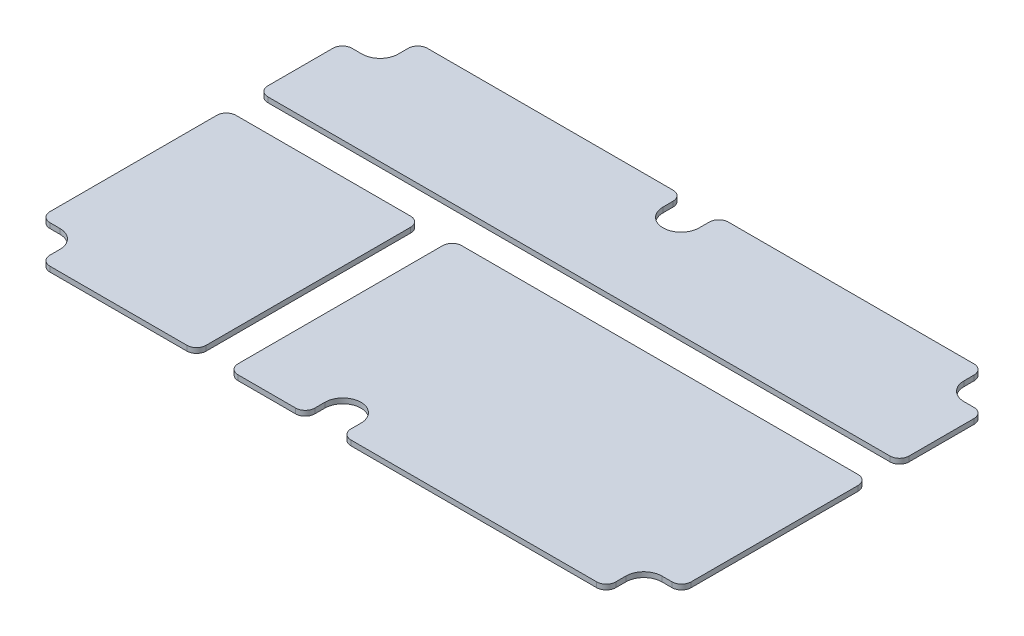
from build123d import *

# Parameters (mm, degrees)
BOSS_EXTRUDE1_DEPTH   = 1.6
BOSS_EXTRUDE1_2_DEPTH = 1.6
BOSS_EXTRUDE1_3_DEPTH = 1.6


with BuildPart() as part:
    # Sketch1 → Boss-Extrude1 (new body)
    with BuildSketch(Plane(origin=(0, 0, 0), x_dir=(1, 0, 0), z_dir=(0, 1, 0))):
        with BuildLine():
            ThreePointArc((5.656122312, -56.056304816), (6.534801968, -58.17762516), (8.656122312, -59.056304816))
            Line((8.656122312, -59.056304816), (85.540799201, -59.056304816))
            ThreePointArc((85.540799201, -59.056304816), (87.662119545, -58.17762516), (88.540799201, -56.056304816))
            Line((88.540799201, -56.056304816), (88.540799201, -52.918768599))
            ThreePointArc((88.540799201, -52.918768599), (90.197439071, -48.919286157), (94.196921513, -47.262646288))
            Line((94.196921513, -47.262646288), (97.331304816, -47.262646288))
            ThreePointArc((97.331304816, -47.262646288), (99.45262516, -46.383966631), (100.331304816, -44.262646288))
            Line((100.331304816, -44.262646288), (100.331304816, 7.943695184))
            ThreePointArc((100.331304816, 7.943695184), (99.45262516, 10.065015527), (97.331304816, 10.943695184))
            Line((97.331304816, 10.943695184), (-26.668695184, 10.943695184))
            ThreePointArc((-26.668695184, 10.943695184), (-28.790015527, 10.065015527), (-29.668695184, 7.943695184))
            Line((-29.668695184, 7.943695184), (-29.668695184, -56.056304816))
            ThreePointArc((-29.668695184, -56.056304816), (-28.790015527, -58.17762516), (-26.668695184, -59.056304816))
            Line((-26.668695184, -59.056304816), (-8.656122312, -59.056304816))
            ThreePointArc((-8.656122312, -59.056304816), (-6.534801968, -58.17762516), (-5.656122312, -56.056304816))
            Line((-5.656122312, -56.056304816), (-5.656122312, -52.918768599))
            ThreePointArc((-5.656122312, -52.918768599), (0, -47.262646288), (5.656122312, -52.918768599))
            Line((5.656122312, -52.918768599), (5.656122312, -56.056304816))
        make_face()
    extrude(amount=BOSS_EXTRUDE1_DEPTH)


with BuildPart() as body_2:
    # Sketch1 → Boss-Extrude1 2 (new body)
    with BuildSketch(Plane(origin=(0, 0, 0), x_dir=(1, 0, 0), z_dir=(0, 1, 0))):
        with BuildLine():
            Line((-8.656122312, 59.056304816), (-85.540799201, 59.056304816))
            ThreePointArc((-85.540799201, 59.056304816), (-87.662119545, 58.17762516), (-88.540799201, 56.056304816))
            Line((-88.540799201, 56.056304816), (-88.540799201, 52.918768599))
            ThreePointArc((-88.540799201, 52.918768599), (-90.197439071, 48.919286157), (-94.196921513, 47.262646288))
            Line((-94.196921513, 47.262646288), (-97.331304816, 47.262646288))
            ThreePointArc((-97.331304816, 47.262646288), (-99.45262516, 46.383966631), (-100.331304816, 44.262646288))
            Line((-100.331304816, 44.262646288), (-100.331304816, 23.943695184))
            ThreePointArc((-100.331304816, 23.943695184), (-99.45262516, 21.82237484), (-97.331304816, 20.943695184))
            Line((-97.331304816, 20.943695184), (97.331304816, 20.943695184))
            ThreePointArc((97.331304816, 20.943695184), (99.45262516, 21.82237484), (100.331304816, 23.943695184))
            Line((100.331304816, 23.943695184), (100.331304816, 44.262646288))
            ThreePointArc((100.331304816, 44.262646288), (99.45262516, 46.383966631), (97.331304816, 47.262646288))
            Line((97.331304816, 47.262646288), (94.196921513, 47.262646288))
            ThreePointArc((94.196921513, 47.262646288), (90.197439071, 48.919286157), (88.540799201, 52.918768599))
            Line((88.540799201, 52.918768599), (88.540799201, 56.056304816))
            ThreePointArc((88.540799201, 56.056304816), (87.662119545, 58.17762516), (85.540799201, 59.056304816))
            Line((85.540799201, 59.056304816), (8.656122312, 59.056304816))
            ThreePointArc((8.656122312, 59.056304816), (6.534801968, 58.17762516), (5.656122312, 56.056304816))
            Line((5.656122312, 56.056304816), (5.656122312, 52.918768599))
            ThreePointArc((5.656122312, 52.918768599), (0, 47.262646288), (-5.656122312, 52.918768599))
            Line((-5.656122312, 52.918768599), (-5.656122312, 56.056304816))
            ThreePointArc((-5.656122312, 56.056304816), (-6.534801968, 58.17762516), (-8.656122312, 59.056304816))
        make_face()
    extrude(amount=BOSS_EXTRUDE1_2_DEPTH)


with BuildPart() as body_3:
    # Sketch1 → Boss-Extrude1 3 (new body)
    with BuildSketch(Plane(origin=(0, 0, 0), x_dir=(1, 0, 0), z_dir=(0, 1, 0))):
        with BuildLine():
            Line((-42.668695184, 10.943695184), (-97.331304816, 10.943695184))
            ThreePointArc((-97.331304816, 10.943695184), (-99.45262516, 10.065015527), (-100.331304816, 7.943695184))
            Line((-100.331304816, 7.943695184), (-100.331304816, -44.262646288))
            ThreePointArc((-100.331304816, -44.262646288), (-99.45262516, -46.383966631), (-97.331304816, -47.262646288))
            Line((-97.331304816, -47.262646288), (-94.196921513, -47.262646288))
            ThreePointArc((-94.196921513, -47.262646288), (-90.197439071, -48.919286157), (-88.540799201, -52.918768599))
            Line((-88.540799201, -52.918768599), (-88.540799201, -56.056304816))
            ThreePointArc((-88.540799201, -56.056304816), (-87.662119545, -58.17762516), (-85.540799201, -59.056304816))
            Line((-85.540799201, -59.056304816), (-42.668695184, -59.056304816))
            ThreePointArc((-42.668695184, -59.056304816), (-40.54737484, -58.17762516), (-39.668695184, -56.056304816))
            Line((-39.668695184, -56.056304816), (-39.668695184, 7.943695184))
            ThreePointArc((-39.668695184, 7.943695184), (-40.54737484, 10.065015527), (-42.668695184, 10.943695184))
        make_face()
    extrude(amount=BOSS_EXTRUDE1_3_DEPTH)


solid = Compound([part.part, body_2.part, body_3.part])
